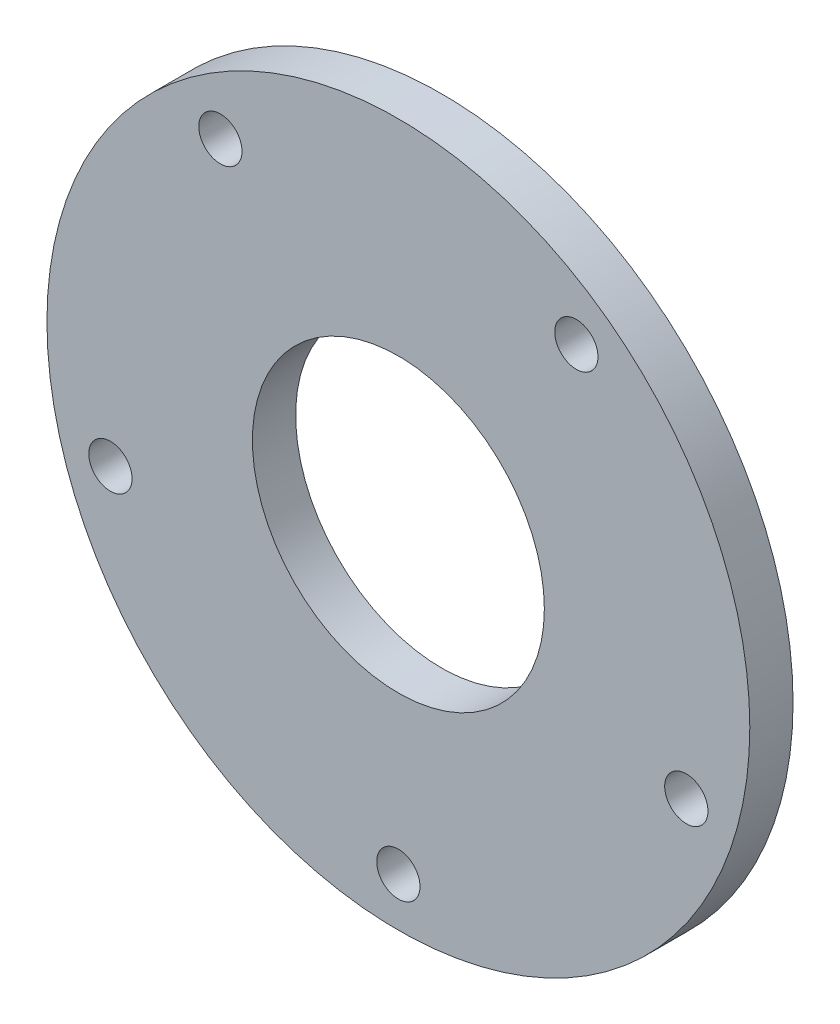
from build123d import *

# Parameters (mm, degrees)
SKETCH_1_R      = 32.5
SKETCH_1_R_2    = 13.5
SKETCH_1_R_3    = 2
EXTRUDE_1_DEPTH = 4


with BuildPart() as part:
    # 草图1 → 凸台-拉伸1 (new body)
    with BuildSketch(Plane.XY):
        Circle(SKETCH_1_R)
        Circle(SKETCH_1_R_2, mode=Mode.SUBTRACT)
        with Locations((0, -28)):
            Circle(SKETCH_1_R_3, mode=Mode.SUBTRACT)
        with Locations((-26.629582456, -8.652475842)):
            Circle(SKETCH_1_R_3, mode=Mode.SUBTRACT)
        with Locations((-16.457987064, 22.652475842)):
            Circle(SKETCH_1_R_3, mode=Mode.SUBTRACT)
        with Locations((16.457987064, 22.652475842)):
            Circle(SKETCH_1_R_3, mode=Mode.SUBTRACT)
        with Locations((26.629582456, -8.652475842)):
            Circle(SKETCH_1_R_3, mode=Mode.SUBTRACT)
    extrude(amount=EXTRUDE_1_DEPTH)


solid = part.part
